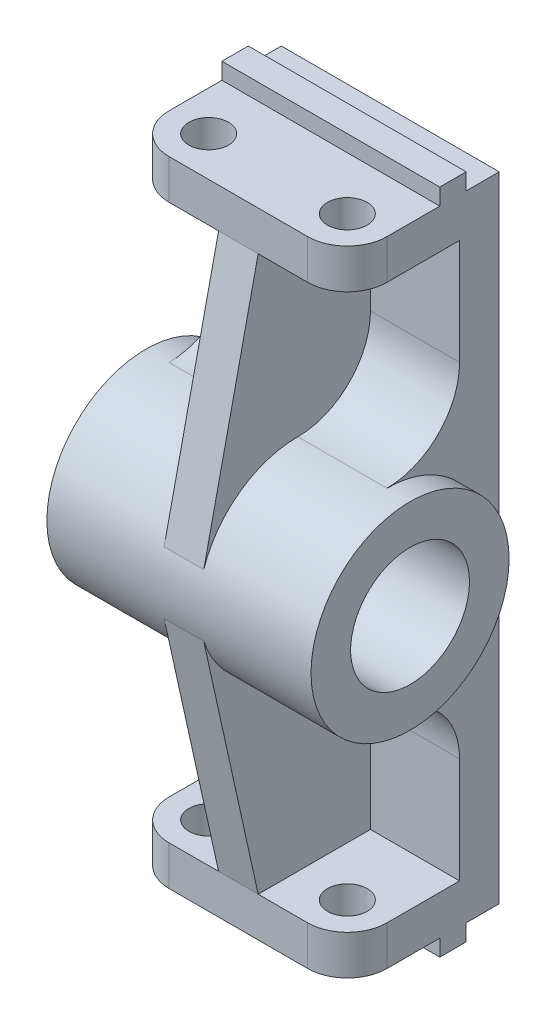
from build123d import *

# Parameters (mm, degrees)
BOSS_EXTRUDE1_DEPTH = 33
SKETCH1_3_R         = 30
BOSS_EXTRUDE2_DEPTH = 40
FILLET1_R           = 22
RIB1_REACH          = 115.829
SKETCH2_WALL_W      = 306.068234896
SKETCH2_WALL_H      = 12
FILLET2_R           = 12
SKETCH3_R           = 6
CUT_EXTRUDE1_DEPTH  = 12
CUT_EXTRUDE2_START  = -12
SKETCH4_R           = 6
CUT_EXTRUDE2_DEPTH  = 12
SKETCH5_R           = 18
CUT_EXTRUDE3_DEPTH  = 80


with BuildPart() as part:
    # Sketch1 → Boss-Extrude1 (new, symmetric)
    with BuildSketch(Plane.YZ):
        with BuildLine():
            Line((-96, -24), (-96, -34))
            Line((-96, -34), (96, -34))
            Line((96, -34), (96, -24))
            Line((96, -24), (101, -24))
            Line((101, -24), (101, -16))
            Line((101, -16), (96, -16))
            Line((96, -16), (96, 12))
            Line((96, 12), (84, 12))
            Line((84, 12), (84, -22))
            Line((84, -22), (20.396078054, -22))
            ThreePointArc((20.396078054, -22), (0, -30), (-20.396078054, -22))
            Line((-20.396078054, -22), (-84, -22))
            Line((-84, -22), (-84, 12))
            Line((-84, 12), (-96, 12))
            Line((-96, 12), (-96, -16))
            Line((-96, -16), (-101, -16))
            Line((-101, -16), (-101, -24))
            Line((-101, -24), (-96, -24))
        make_face()
    extrude(amount=BOSS_EXTRUDE1_DEPTH, both=True)

    # Sketch1<3> → Boss-Extrude2 (add, symmetric)
    with BuildSketch(Plane.YZ):
        with Locations(Location((0, 0, 0), (0, 0, 270))):
            Circle(SKETCH1_3_R)
    extrude(amount=BOSS_EXTRUDE2_DEPTH, both=True)

    # Fillet1
    fillet1_edges = [part.edges().sort_by_distance(p)[0] for p in [
        (0, 20.396078054, -22),
        (0, -20.396078054, -22),
    ]]
    fillet(fillet1_edges, radius=FILLET1_R)

    # Sketch2 wall → Rib1 (add, up to next)
    with BuildSketch(Plane(origin=(0, -46.695244813, 20.246216205), x_dir=(0, 0.97642883454, 0.215839595718), z_dir=(0, -0.215839595718, 0.97642883454)), mode=Mode.PRIVATE) as rib1_sk1:
        Rectangle(SKETCH2_WALL_W, SKETCH2_WALL_H)
    rib1_tool1 = extrude(rib1_sk1.sketch, amount=-RIB1_REACH, mode=Mode.PRIVATE) - part.part
    rib1 = rib1_tool1.solids().sort_by_distance((0, -46.695244813, 20.246216205))[0]
    add(rib1)

    # Mirror1: Rib1 across plane
    add(rib1.mirror(Plane.ZX))

    # Fillet2
    fillet2_edges = [part.edges().sort_by_distance(p)[0] for p in [
        (-33, 90, 12),
        (33, -90, 12),
        (-33, -90, 12),
        (33, 90, 12),
    ]]
    fillet(fillet2_edges, radius=FILLET2_R)

    # Sketch3 → Cut-Extrude1 (cut)
    with BuildSketch(Plane(origin=(0, 96, 0), x_dir=(-1, 0, 0), z_dir=(0, 1, 0))):
        with Locations(Location((-21, 0, 0), (0, 0, 90))):
            Circle(SKETCH3_R)
        with Locations(Location((21, 0, 0), (0, 0, 90))):
            Circle(SKETCH3_R)
    extrude(amount=-CUT_EXTRUDE1_DEPTH, mode=Mode.SUBTRACT)

    # Sketch4 → Cut-Extrude2 (cut)
    with BuildSketch(Plane.XZ.offset(96).offset(CUT_EXTRUDE2_START)):
        with Locations(Location((-21, 0, 0), (0, 0, 90))):
            Circle(SKETCH4_R)
        with Locations(Location((21, 0, 0), (0, 0, 90))):
            Circle(SKETCH4_R)
    extrude(amount=CUT_EXTRUDE2_DEPTH, mode=Mode.SUBTRACT)

    # Sketch5 → Cut-Extrude3 (cut)
    with BuildSketch(Plane.YZ.offset(40)):
        with Locations(Location((0, 0, 0), (0, 0, 270))):
            Circle(SKETCH5_R)
    extrude(amount=-CUT_EXTRUDE3_DEPTH, mode=Mode.SUBTRACT)


solid = part.part
